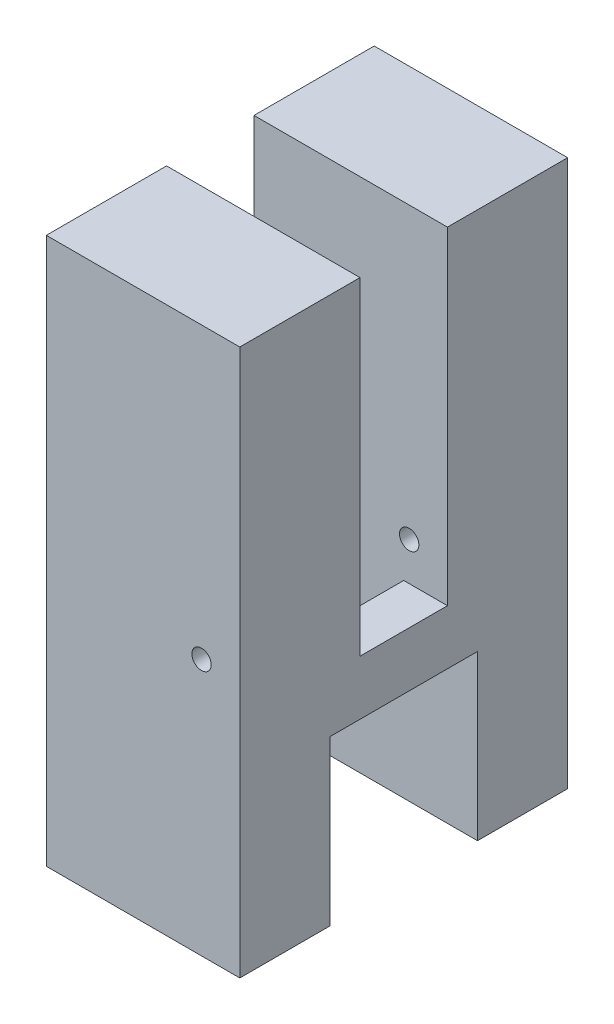
from build123d import *

# Parameters (mm, degrees)
SKETCH1_W               = 36.068
SKETCH1_H               = 38.1
BOSS_EXTRUDE1_DEPTH     = 63.5
SKETCH3_W               = 36.068
SKETCH3_H               = 10.16
CUT_EXTRUDE1_DEPTH      = 38.1
SKETCH4_W               = 36.068
SKETCH4_H               = 17.145
CUT_EXTRUDE2_DEPTH      = 19.05
SKETCH5_W               = 17.399
SKETCH5_H               = 10.16
CUT_EXTRUDE3_DEPTH      = 47.257298408
CUT_EXTRUDE4_DEPTH      = 71.283227416
CUT_EXTRUDE4_DEPTH_BACK = 71.283227416
SKETCH6_R               = 1.125
SKETCH7_W               = 13.589
SKETCH7_H               = 38.1
CUT_EXTRUDE6_DEPTH      = 69.705004592
SKETCH8_W               = 10.16
SKETCH8_H               = 6.35
BOSS_EXTRUDE2_DEPTH     = 3.81


with BuildPart() as part:
    # Sketch1 → Boss-Extrude1 (new body)
    with BuildSketch(Plane(origin=(0, 0, 0), x_dir=(1, 0, 0), z_dir=(0, 1, 0))):
        Rectangle(SKETCH1_W, SKETCH1_H)
    extrude(amount=BOSS_EXTRUDE1_DEPTH)

    # Sketch3 → Cut-Extrude1 (cut)
    with BuildSketch(Plane(origin=(0, 63.5, 0), x_dir=(1, 0, 0), z_dir=(0, 1, 0))):
        Rectangle(SKETCH3_W, SKETCH3_H)
    extrude(amount=-CUT_EXTRUDE1_DEPTH, mode=Mode.SUBTRACT)

    # Sketch4 → Cut-Extrude2 (cut)
    with BuildSketch(Plane.XZ):
        Rectangle(SKETCH4_W, SKETCH4_H)
    extrude(amount=-CUT_EXTRUDE2_DEPTH, mode=Mode.SUBTRACT)

    # Sketch5 → Cut-Extrude3 (cut, through all)
    with BuildSketch(Plane(origin=(0, 25.4, 0), x_dir=(1, 0, 0), z_dir=(0, 1, 0))):
        with Locations((-9.3345, 0)):
            Rectangle(SKETCH5_W, SKETCH5_H)
        with Locations((9.3345, 0)):
            Rectangle(SKETCH5_W, SKETCH5_H)
    extrude(amount=-CUT_EXTRUDE3_DEPTH, mode=Mode.SUBTRACT)

    # Sketch6 → Cut-Extrude4 (cut, two sides: drawn at the far end of the back side and taken through both)
    with BuildSketch(Plane.XY.offset(-5.08).offset(-CUT_EXTRUDE4_DEPTH_BACK)):
        with Locations((0, 29.845)):
            Circle(SKETCH6_R)
    extrude(amount=CUT_EXTRUDE4_DEPTH + CUT_EXTRUDE4_DEPTH_BACK, mode=Mode.SUBTRACT)

    # Sketch7 → Cut-Extrude6 (cut, through all)
    with BuildSketch(Plane(origin=(0, 63.5, 0), x_dir=(1, 0, 0), z_dir=(0, 1, 0))):
        with Locations((11.2395, 0)):
            Rectangle(SKETCH7_W, SKETCH7_H)
    extrude(amount=-CUT_EXTRUDE6_DEPTH, mode=Mode.SUBTRACT)

    # Sketch8 → Boss-Extrude2 (add)
    with BuildSketch(Plane(origin=(0.635, 0, 0), x_dir=(0, 0, -1), z_dir=(1, 0, 0))):
        with Locations((0, 22.225)):
            Rectangle(SKETCH8_W, SKETCH8_H)
    extrude(amount=BOSS_EXTRUDE2_DEPTH)


solid = part.part
